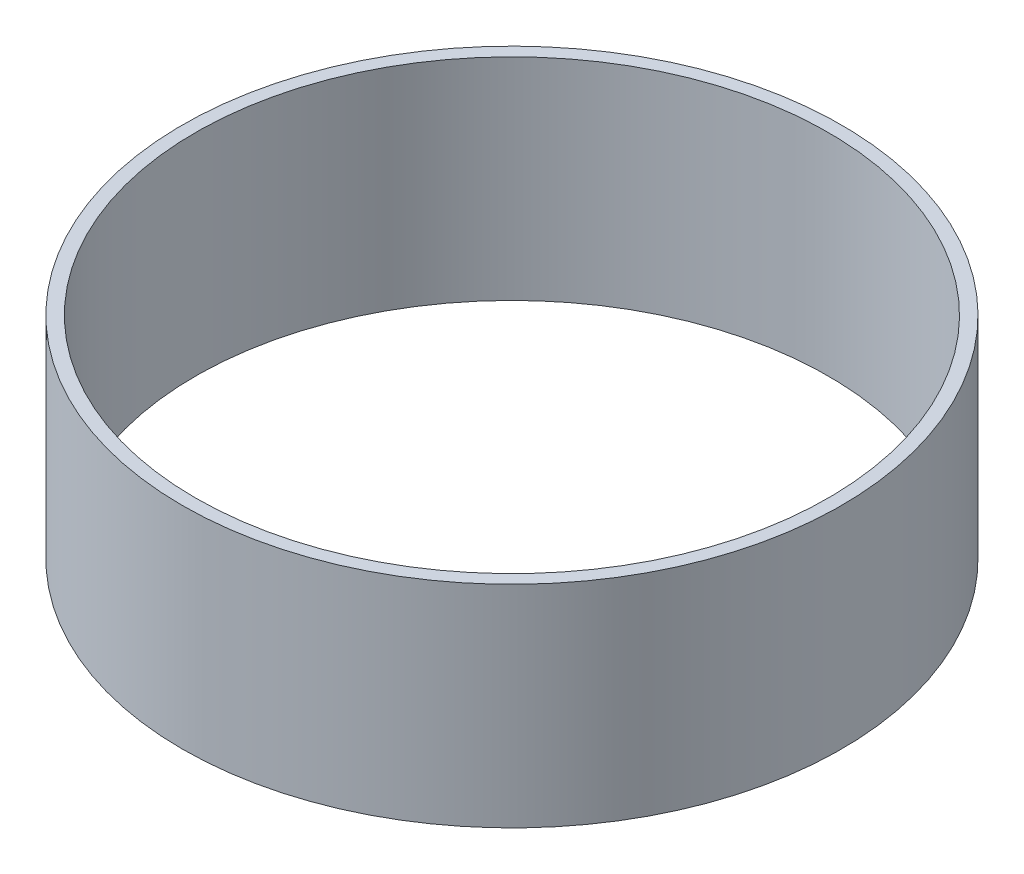
from build123d import *

# Parameters (mm, degrees)
SKETCH1_R           = 39.6748
SKETCH1_R_2         = 38.1
BOSS_EXTRUDE1_DEPTH = 12.7


with BuildPart() as part:
    # Sketch1 → Boss-Extrude1 (new, symmetric)
    with BuildSketch(Plane(origin=(0, 0, 0), x_dir=(1, 0, 0), z_dir=(0, 1, 0))):
        with Locations(Location((0, 0, 0), (0, 0, 270))):
            Circle(SKETCH1_R)
        with Locations(Location((0, 0, 0), (0, 0, 270))):
            Circle(SKETCH1_R_2, mode=Mode.SUBTRACT)
    extrude(amount=BOSS_EXTRUDE1_DEPTH, both=True)


solid = part.part
